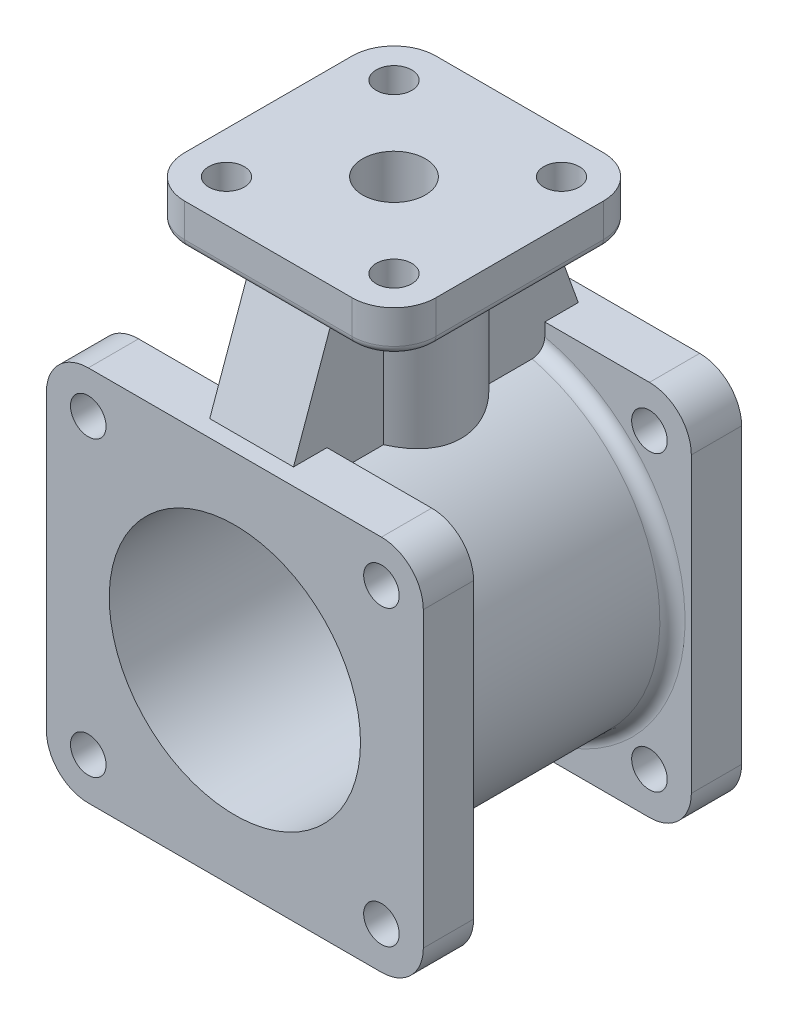
from build123d import *

# Parameters (mm, degrees)
SKETCH_8_R                      = 40
EXTRUDE_3_DEPTH                 = 26
EXTRUDE_4_DEPTH                 = 12
HOLE_WIZARD_M10_1_D             = 8.5
CUT_EXTRUDE_2_DEPTH             = 100.126182212
CUT_EXTRUDE_2_DEPTH_BACK        = 100.126182212
SKETCH_16_R                     = 30
EXTRUDE_6_DEPTH                 = 10
SKETCH_20_W                     = 4.25
SKETCH_20_H                     = 60.639320225
HOLE_WIZARD_M10_3_AT_2_COUNT    = 2
HOLE_WIZARD_M10_3_AT_2_PITCH    = 40
HOLE_WIZARD_M10_3_AT_3_COUNT    = 2
HOLE_WIZARD_M10_3_AT_3_PITCH    = 40
HOLE_WIZARD_M10_3_AT_4_COUNT    = 2
HOLE_WIZARD_M10_3_AT_4_PITCH    = 56.568542495
EXTRUDE_7_REACH                 = 142.901
EXTRUDE_7_END_RADIUS            = 40
SKETCH_21_R                     = 16
CUT_EXTRUDE_3_REACH             = 142.901
SKETCH_22_R                     = 7.5
CUT_EXTRUDE_3_DIRECTION_2_DEPTH = 141.900674235
RIB_1_REACH                     = 103.774
SKETCH_27_WALL_W                = 235.280657746
SKETCH_27_WALL_H                = 20
FILLET_1_R                      = 2
FILLET_4_R                      = 3


with BuildPart() as part:
    # 草图8 → 凸台-拉伸3 (new, symmetric)
    with BuildSketch(Plane.XY):
        with Locations(Location((0.490242747, 0, 0), (0, 0, 180))):
            Circle(SKETCH_8_R)
    extrude(amount=EXTRUDE_3_DEPTH, both=True)

    # 草图10 → 凸台-拉伸4 (add)
    with BuildSketch(Plane.XY.offset(26)):
        with BuildLine():
            Line((-35, -45), (35, -45))
            ThreePointArc((35, -45), (42.071067812, -42.071067812), (45, -35))
            Line((45, -35), (45, 35))
            ThreePointArc((45, 35), (42.071067812, 42.071067812), (35, 45))
            Line((35, 45), (-35, 45))
            ThreePointArc((-35, 45), (-42.071067812, 42.071067812), (-45, 35))
            Line((-45, 35), (-45, -35))
            ThreePointArc((-45, -35), (-42.071067812, -42.071067812), (-35, -45))
        make_face()
    extrude_4 = extrude(amount=EXTRUDE_4_DEPTH)

    # M10 螺纹孔1 (through all)
    with Locations(Plane.XY.offset(38)):
        with Locations((-35, 35), (35, -35), (35, 35), (-35, -35)):
            hole_wizard_m10_1 = Hole(HOLE_WIZARD_M10_1_D / 2)

    # 镜向1: 凸台-拉伸4, M10 螺纹孔1 across plane
    add(extrude_4.mirror(Plane.XY))
    add(hole_wizard_m10_1.mirror(Plane.XY), mode=Mode.SUBTRACT)

    # 草图16 → 切除-拉伸2 (cut, two sides: drawn at the far end of the back side and taken through both)
    with BuildSketch(Plane.XY.offset(38).offset(-CUT_EXTRUDE_2_DEPTH_BACK)):
        Circle(SKETCH_16_R)
    extrude(amount=CUT_EXTRUDE_2_DEPTH + CUT_EXTRUDE_2_DEPTH_BACK, mode=Mode.SUBTRACT)



with BuildPart() as body_2:
    # 草图17 → 凸台-拉伸6 (new body)
    with BuildSketch(Plane(origin=(0, 83, 0), x_dir=(1, 0, 0), z_dir=(0, 1, 0))):
        with BuildLine():
            Line((-20, -30), (20, -30))
            ThreePointArc((20, -30), (27.071067812, -27.071067812), (30, -20))
            Line((30, -20), (30, 20))
            ThreePointArc((30, 20), (27.071067812, 27.071067812), (20, 30))
            Line((20, 30), (-20, 30))
            ThreePointArc((-20, 30), (-27.071067812, 27.071067812), (-30, 20))
            Line((-30, 20), (-30, -20))
            ThreePointArc((-30, -20), (-27.071067812, -27.071067812), (-20, -30))
        make_face()
    extrude(amount=-EXTRUDE_6_DEPTH)

    # 草图20 → M10 螺纹孔3 (revolve, cut)
    with BuildSketch(Plane(origin=(-20, 83, -20), x_dir=(0, 0, 1), z_dir=(1, 0, 0))):
        with Locations((2.125, 30.319660113)):
            Rectangle(SKETCH_20_W, SKETCH_20_H)
    hole_wizard_m10_3 = revolve(axis=Axis((-20, 89.35, -20), (0, -1, 0)), mode=Mode.SUBTRACT)

    # M10 螺纹孔3 at 2: M10 螺纹孔3 ×2
    with Locations(*[(i * HOLE_WIZARD_M10_3_AT_2_PITCH, 0, 0) for i in range(1, HOLE_WIZARD_M10_3_AT_2_COUNT)]):
        add(hole_wizard_m10_3, mode=Mode.SUBTRACT)

    # M10 螺纹孔3 at 3: M10 螺纹孔3 ×2
    with Locations(*[(0, 0, i * HOLE_WIZARD_M10_3_AT_3_PITCH) for i in range(1, HOLE_WIZARD_M10_3_AT_3_COUNT)]):
        add(hole_wizard_m10_3, mode=Mode.SUBTRACT)

    # M10 螺纹孔3 at 4: M10 螺纹孔3 ×2
    with Locations(*[Vector(0.7071067811865476, 0, 0.7071067811865476) * (i * HOLE_WIZARD_M10_3_AT_4_PITCH) for i in range(1, HOLE_WIZARD_M10_3_AT_4_COUNT)]):
        add(hole_wizard_m10_3, mode=Mode.SUBTRACT)


with BuildPart() as part_1:
    add(part.part)

    add(body_2.part)  # 凸台-拉伸7 merges body 2
    # 凸台-拉伸7: up to this cylinder (the profile starts outside it)
    extrude_7_end = Plane(origin=(0.490242747, 0, 0), z_dir=(0, 0, -1)) * Cylinder(EXTRUDE_7_END_RADIUS, 366.802, mode=Mode.PRIVATE)
    # 草图21 → 凸台-拉伸7 (add, up to the surface)
    with BuildSketch(Plane(origin=(0, 83, 0), x_dir=(1, 0, 0), z_dir=(0, 1, 0)), mode=Mode.PRIVATE) as extrude_7_sk1:
        with Locations(Location((0, 0, 0), (0, 0, 270))):
            Circle(SKETCH_21_R)
    extrude_7_tool1 = extrude(extrude_7_sk1.sketch, amount=-EXTRUDE_7_REACH, mode=Mode.PRIVATE) - extrude_7_end
    add(extrude_7_tool1.solids().sort_by_distance((0, 83, 0))[0])

    # 草图22 → 切除-拉伸3 (cut, up to next)
    with BuildSketch(Plane(origin=(0, 83, 0), x_dir=(1, 0, 0), z_dir=(0, 1, 0)), mode=Mode.PRIVATE) as cut_extrude_3_sk1:
        with Locations(Location((0, 0, 0), (0, 0, 270))):
            Circle(SKETCH_22_R)
    cut_extrude_3_tool1 = extrude(cut_extrude_3_sk1.sketch, amount=-CUT_EXTRUDE_3_REACH, mode=Mode.PRIVATE) & part_1.part
    add(cut_extrude_3_tool1.solids().sort_by_distance((0, 83, 0))[0], mode=Mode.SUBTRACT)

    # 草图22 → 切除-拉伸3 direction 2 (cut)
    with BuildSketch(Plane(origin=(0, 83, 0), x_dir=(1, 0, 0), z_dir=(0, 1, 0))):
        with Locations(Location((0, 0, 0), (0, 0, 270))):
            Circle(SKETCH_22_R)
    extrude(amount=CUT_EXTRUDE_3_DIRECTION_2_DEPTH, mode=Mode.SUBTRACT)

    # 草图27 wall → 筋1 (add, up to next)
    with BuildSketch(Plane(origin=(0, 59, 29), x_dir=(0, -0.941741911595, 0.336336396998), z_dir=(0, -0.336336396998, -0.941741911595)), mode=Mode.PRIVATE) as rib_1_sk1:
        Rectangle(SKETCH_27_WALL_W, SKETCH_27_WALL_H)
    rib_1_tool1 = extrude(rib_1_sk1.sketch, amount=RIB_1_REACH, mode=Mode.PRIVATE) - part_1.part
    rib_1 = rib_1_tool1.solids().sort_by_distance((0, 59, 29))[0]
    add(rib_1)

    # 镜向2: 筋1 across plane
    add(rib_1.mirror(Plane.XY))

    # 圆角1
    fillet_1_edges = [part_1.edges().sort_by_distance(p)[0] for p in [
        (-16, 73, 0),
        (27.071067812, 73, 27.071067812),
        (0, 73, 30),
        (-27.071067812, 73, 27.071067812),
        (-30, 73, 0),
        (-27.071067812, 73, -27.071067812),
        (0, 73, -30),
        (27.071067812, 73, -27.071067812),
        (30, 73, 0),
        (-20, 73, -24.25),
        (20, 73, -24.25),
        (-20, 73, 15.75),
        (20, 73, 15.75),
        (0, 73, 24),
        (10, 73, 18.244997998),
        (-10, 73, 18.244997998),
        (16, 73, 0),
        (0, 73, -24),
        (10, 73, -18.244997998),
        (-10, 73, -18.244997998),
    ]]
    fillet(fillet_1_edges, radius=FILLET_1_R)

    # 圆角4
    fillet_4_edges = [part_1.edges().sort_by_distance(p)[0] for p in [
        (0.996565984, -39.996795331, 26),
        (0.996565984, -39.996795331, -26),
    ]]
    fillet(fillet_4_edges, radius=FILLET_4_R)


solid = part_1.part
